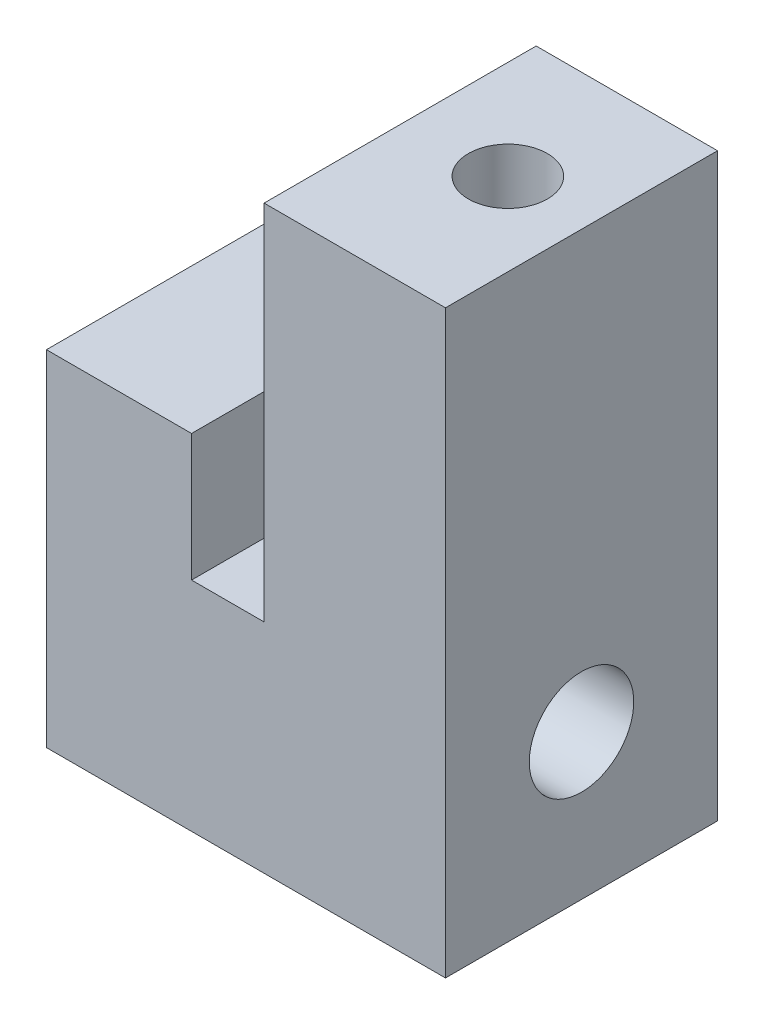
from build123d import *

# Parameters (mm, degrees)
SKETCH1_W                 = 17.4625
SKETCH1_H                 = 11.90625
BOSS_EXTRUDE1_DEPTH       = 25.4
SKETCH2_W                 = 3.175
SKETCH2_H                 = 5.55625
CUT_EXTRUDE1_DEPTH        = 25.4
SKETCH4_R                 = 2.286
CUT_EXTRUDE2_DEPTH        = 25.4
F_8_32_TAPPED_HOLE1_D     = 3.4544
F_8_32_TAPPED_HOLE1_DEPTH = 11.1125
F_8_32_TAPPED_HOLE1_TIP   = 1.037806461


with BuildPart() as part:
    # Sketch1 → Boss-Extrude1 (new body)
    with BuildSketch(Plane(origin=(0, 0, 0), x_dir=(1, 0, 0), z_dir=(0, 1, 0))):
        with Locations((8.73125, 5.953125)):
            Rectangle(SKETCH1_W, SKETCH1_H)
    extrude(amount=BOSS_EXTRUDE1_DEPTH)

    # Sketch2 → Cut-Extrude1 (cut)
    with BuildSketch(Plane.XY):
        Polygon((0, 15.08125), (6.35, 15.08125), (9.525, 15.08125), (9.525, 25.4), (0, 25.4), align=None)
        with Locations((7.9375, 12.303125)):
            Rectangle(SKETCH2_W, SKETCH2_H)
    extrude(amount=-CUT_EXTRUDE1_DEPTH, mode=Mode.SUBTRACT)

    # Sketch4 → Cut-Extrude2 (cut)
    with BuildSketch(Plane.ZY):
        with Locations((-5.953125, 6.35)):
            Circle(SKETCH4_R)
    extrude(amount=-CUT_EXTRUDE2_DEPTH, mode=Mode.SUBTRACT)

    # #8-32 Tapped Hole1
    with Locations(Plane(origin=(0, 25.4, 0), x_dir=(1, 0, 0), z_dir=(0, 1, 0))):
        with Locations((13.843, 6.35)):
            Hole(F_8_32_TAPPED_HOLE1_D / 2, depth=F_8_32_TAPPED_HOLE1_DEPTH)
            with Locations((0, 0, -(F_8_32_TAPPED_HOLE1_DEPTH + F_8_32_TAPPED_HOLE1_TIP / 2))):  # 118° drill point
                Cone(0, F_8_32_TAPPED_HOLE1_D / 2, F_8_32_TAPPED_HOLE1_TIP, mode=Mode.SUBTRACT)


solid = part.part
